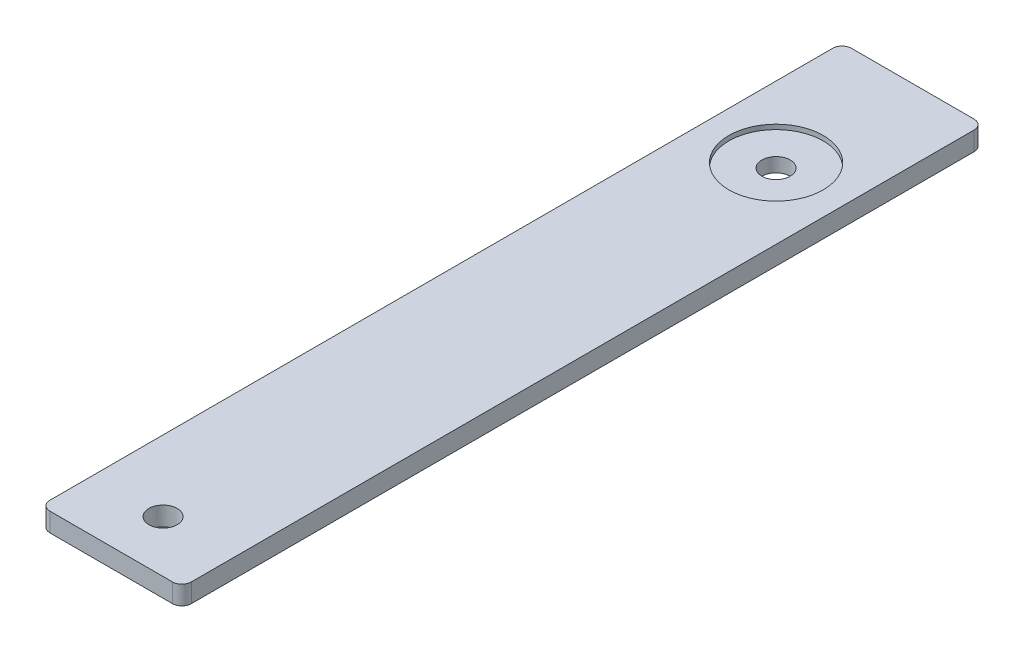
from build123d import *

# Parameters (mm, degrees)
SKETCH1_W           = 15
SKETCH1_H           = 85
SKETCH1_R           = 1.5
BOSS_EXTRUDE1_DEPTH = 2
SKETCH2_R           = 5
CUT_EXTRUDE1_DEPTH  = 0.5
FILLET1_R           = 1


with BuildPart() as part:
    # Sketch1 → Boss-Extrude1 (new body)
    with BuildSketch(Plane(origin=(0, 0, 0), x_dir=(1, 0, 0), z_dir=(0, 1, 0))):
        with Locations((7.5, 42.5)):
            Rectangle(SKETCH1_W, SKETCH1_H)
        with Locations(Location((7.5, 70.5, 0), (0, 0, 270))):
            Circle(SKETCH1_R, mode=Mode.SUBTRACT)
        with Locations(Location((7.5, 5.5, 0), (0, 0, 270))):
            Circle(SKETCH1_R, mode=Mode.SUBTRACT)
    extrude(amount=BOSS_EXTRUDE1_DEPTH)

    # Sketch2 → Cut-Extrude1 (cut)
    with BuildSketch(Plane(origin=(0, 2, 0), x_dir=(1, 0, 0), z_dir=(0, 1, 0))):
        with Locations(Location((7.5, 70.5, 0), (0, 0, 270))):
            Circle(SKETCH2_R)
    extrude(amount=-CUT_EXTRUDE1_DEPTH, mode=Mode.SUBTRACT)

    # Fillet1
    fillet1_edges = [part.edges().sort_by_distance(p)[0] for p in [
        (0, 1, -85),
        (15, 1, -85),
        (15, 1, 0),
        (0, 1, 0),
    ]]
    fillet(fillet1_edges, radius=FILLET1_R)


solid = part.part
